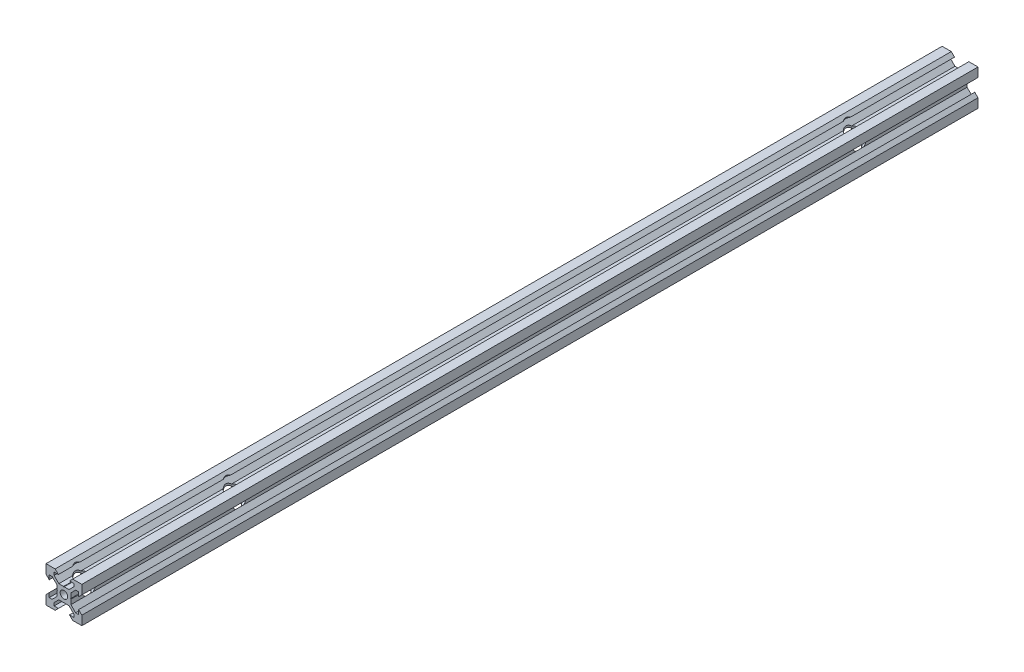
from build123d import *

# Parameters (mm, degrees)
SKETCH1_R           = 2.1
BOSS_EXTRUDE1_DEPTH = 500
SKETCH2_R           = 0.2
CUT_EXTRUDE1_DEPTH  = 501.199960016
CUT_EXTRUDE2_REACH  = 502.5
SKETCH6_R           = 3.675
CUT_EXTRUDE3_REACH  = 502.5
SKETCH7_R           = 3.675


with BuildPart() as part:
    # Sketch1 → Boss-Extrude1 (new body)
    with BuildSketch(Plane.XY):
        Polygon((-10, -4.9), (-10, -10), (-4.9, -10), (-3.1, -8.2), (-5.499339828, -8.2), (-5.499339828, -6.56), (-2.84, -3.900660172), (2.84, -3.900660172), (5.499339828, -6.56), (5.499339828, -8.2), (3.1, -8.2), (4.9, -10), (10, -10), (10, -4.9), (8.2, -3.1), (8.2, -5.499339828), (6.56, -5.499339828), (3.900660172, -2.84), (3.900660172, 2.84), (6.56, 5.499339828), (8.2, 5.499339828), (8.2, 3.1), (10, 4.9), (10, 10), (4.9, 10), (3.1, 8.2), (5.499339828, 8.2), (5.499339828, 6.56), (2.84, 3.900660172), (-2.84, 3.900660172), (-5.499339828, 6.56), (-5.499339828, 8.2), (-3.1, 8.2), (-4.9, 10), (-10, 10), (-10, 4.9), (-8.2, 3.1), (-8.2, 5.499339828), (-6.56, 5.499339828), (-3.900660172, 2.84), (-3.900660172, -2.84), (-6.56, -5.499339828), (-8.2, -5.499339828), (-8.2, -3.1), align=None)
        Circle(SKETCH1_R, mode=Mode.SUBTRACT)
    extrude(amount=BOSS_EXTRUDE1_DEPTH)

    # Sketch2 → Cut-Extrude1 (cut, through all)
    with BuildSketch(Plane(origin=(0, 0, 0), x_dir=(-1, 0, 0), z_dir=(0, 0, -1))):
        with Locations((0, 3.900660172)):
            Circle(SKETCH2_R)
        with Locations((3.900660172, 0)):
            Circle(SKETCH2_R)
        with Locations((0, -3.900660172)):
            Circle(SKETCH2_R)
        with Locations((-3.900660172, 0)):
            Circle(SKETCH2_R)
    extrude(amount=-CUT_EXTRUDE1_DEPTH, mode=Mode.SUBTRACT)

    # Cut-Extrude2: up to this face of the body (flat: up to its plane)
    cut_extrude2_end = Plane(part.part.faces().sort_by_distance((3.900660172, 1.52, 250))[0])
    # Sketch6 → Cut-Extrude2 (cut, up to the picked face)
    with BuildSketch(Plane.ZY.offset(10), mode=Mode.PRIVATE) as cut_extrude2_sk1:
        with Locations(Location((406, 0, 0), (0, 0, 230.605013939))):
            Circle(SKETCH6_R)
    cut_extrude2_tool1 = split(extrude(cut_extrude2_sk1.sketch, amount=-CUT_EXTRUDE2_REACH, mode=Mode.PRIVATE), bisect_by=cut_extrude2_end, keep=Keep.BOTH, mode=Mode.PRIVATE)
    # Sketch6 → Cut-Extrude2 (cut, up to the picked face)
    with BuildSketch(Plane.ZY.offset(10), mode=Mode.PRIVATE) as cut_extrude2_sk2:
        with Locations(Location((490, 0, 0), (0, 0, 230.605013939))):
            Circle(SKETCH6_R)
    cut_extrude2_tool2 = split(extrude(cut_extrude2_sk2.sketch, amount=-CUT_EXTRUDE2_REACH, mode=Mode.PRIVATE), bisect_by=cut_extrude2_end, keep=Keep.BOTH, mode=Mode.PRIVATE)
    # Sketch6 → Cut-Extrude2 (cut, up to the picked face)
    with BuildSketch(Plane.ZY.offset(10), mode=Mode.PRIVATE) as cut_extrude2_sk3:
        with Locations(Location((60, 0, 0), (0, 0, 309.394986061))):
            Circle(SKETCH6_R)
    cut_extrude2_tool3 = split(extrude(cut_extrude2_sk3.sketch, amount=-CUT_EXTRUDE2_REACH, mode=Mode.PRIVATE), bisect_by=cut_extrude2_end, keep=Keep.BOTH, mode=Mode.PRIVATE)
    add(cut_extrude2_tool1.solids().sort_by(Axis((-10, 0, 406), (1, 0, 0)))[0], mode=Mode.SUBTRACT)
    add(cut_extrude2_tool2.solids().sort_by(Axis((-10, 0, 490), (1, 0, 0)))[0], mode=Mode.SUBTRACT)
    add(cut_extrude2_tool3.solids().sort_by(Axis((-10, 0, 60), (1, 0, 0)))[0], mode=Mode.SUBTRACT)

    # Cut-Extrude3: up to this face of the body (flat: up to its plane)
    cut_extrude3_end = Plane(part.part.faces().sort_by_distance((1.52, -3.900660172, 250))[0])
    # Sketch7 → Cut-Extrude3 (cut, up to the picked face)
    with BuildSketch(Plane(origin=(0, 10, 0), x_dir=(1, 0, 0), z_dir=(0, 1, 0)), mode=Mode.PRIVATE) as cut_extrude3_sk1:
        with Locations(Location((0, -490, 0), (0, 0, 140.605013939))):
            Circle(SKETCH7_R)
    cut_extrude3_tool1 = split(extrude(cut_extrude3_sk1.sketch, amount=-CUT_EXTRUDE3_REACH, mode=Mode.PRIVATE), bisect_by=cut_extrude3_end, keep=Keep.BOTH, mode=Mode.PRIVATE)
    # Sketch7 → Cut-Extrude3 (cut, up to the picked face)
    with BuildSketch(Plane(origin=(0, 10, 0), x_dir=(1, 0, 0), z_dir=(0, 1, 0)), mode=Mode.PRIVATE) as cut_extrude3_sk2:
        with Locations(Location((0, -60, 0), (0, 0, 273.119678895))):
            Circle(SKETCH7_R)
    cut_extrude3_tool2 = split(extrude(cut_extrude3_sk2.sketch, amount=-CUT_EXTRUDE3_REACH, mode=Mode.PRIVATE), bisect_by=cut_extrude3_end, keep=Keep.BOTH, mode=Mode.PRIVATE)
    # Sketch7 → Cut-Extrude3 (cut, up to the picked face)
    with BuildSketch(Plane(origin=(0, 10, 0), x_dir=(1, 0, 0), z_dir=(0, 1, 0)), mode=Mode.PRIVATE) as cut_extrude3_sk3:
        with Locations(Location((0, -406, 0), (0, 0, 266.880321105))):
            Circle(SKETCH7_R)
    cut_extrude3_tool3 = split(extrude(cut_extrude3_sk3.sketch, amount=-CUT_EXTRUDE3_REACH, mode=Mode.PRIVATE), bisect_by=cut_extrude3_end, keep=Keep.BOTH, mode=Mode.PRIVATE)
    add(cut_extrude3_tool1.solids().sort_by(Axis((0, 10, 490), (0, -1, 0)))[0], mode=Mode.SUBTRACT)
    add(cut_extrude3_tool2.solids().sort_by(Axis((0, 10, 60), (0, -1, 0)))[0], mode=Mode.SUBTRACT)
    add(cut_extrude3_tool3.solids().sort_by(Axis((0, 10, 406), (0, -1, 0)))[0], mode=Mode.SUBTRACT)


solid = part.part
